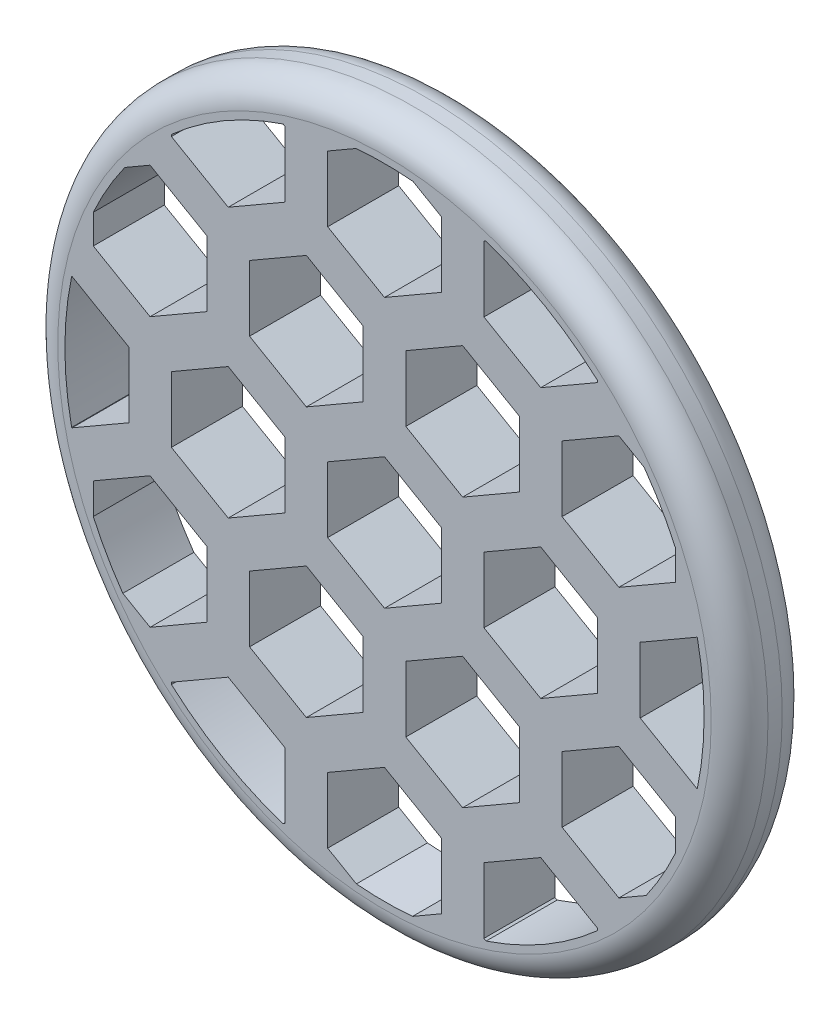
from build123d import *

# Parameters (mm, degrees)
SKETCH1_R           = 25
BOSS_EXTRUDE3_DEPTH = 5
FILLET3_R           = 2


with BuildPart() as part:
    # Sketch1 → Boss-Extrude3 (new body)
    with BuildSketch(Plane.XY):
        Circle(SKETCH1_R)
        with BuildLine():
            Line((-16.5, -14.028532992), (-18.42121658, -12.919318082))
            ThreePointArc((-18.42121658, -12.919318082), (-19.545793828, -11.145041212), (-20.5, -9.273618495))
            Line((-20.5, -9.273618495), (-20.5, -7.100329762))
            Line((-20.5, -7.100329762), (-16.5, -4.790928685))
            Line((-16.5, -4.790928685), (-12.5, -7.100329762))
            Line((-12.5, -7.100329762), (-12.5, -11.719131915))
            Line((-12.5, -11.719131915), (-16.5, -14.028532992))
        make_face(mode=Mode.SUBTRACT)
        with BuildLine():
            Line((-15, -16.770509831), (-15, -16.626609203))
            Line((-15, -16.626609203), (-11, -14.317208127))
            Line((-11, -14.317208127), (-7, -16.626609203))
            Line((-7, -16.626609203), (-7, -21.245411357))
            Line((-7, -21.245411357), (-7.1518668, -21.333091695))
            ThreePointArc((-7.1518668, -21.333091695), (-11.308429997, -19.451720001), (-15, -16.770509831))
        make_face(mode=Mode.SUBTRACT)
        with BuildLine():
            Line((-22, -4.618802154), (-22.023687548, -4.605126141))
            ThreePointArc((-22.023687548, -4.605126141), (-22.5, 0), (-22.023687548, 4.605126141))
            Line((-22.023687548, 4.605126141), (-22, 4.618802154))
            Line((-22, 4.618802154), (-18, 2.309401077))
            Line((-18, 2.309401077), (-18, -2.309401077))
            Line((-18, -2.309401077), (-22, -4.618802154))
        make_face(mode=Mode.SUBTRACT)
        Polygon((-1.5, -11.719131915), (-5.5, -14.028532992), (-9.5, -11.719131915), (-9.5, -7.100329762), (-5.5, -4.790928685), (-1.5, -7.100329762), align=None, mode=Mode.SUBTRACT)
        Polygon((-7, -2.309401077), (-11, -4.618802154), (-15, -2.309401077), (-15, 2.309401077), (-11, 4.618802154), (-7, 2.309401077), align=None, mode=Mode.SUBTRACT)
        with BuildLine():
            Line((4, -21.245411357), (1.977849369, -22.412900568))
            ThreePointArc((1.977849369, -22.412900568), (0, -22.5), (-1.977849369, -22.412900568))
            Line((-1.977849369, -22.412900568), (-4, -21.245411357))
            Line((-4, -21.245411357), (-4, -16.626609203))
            Line((-4, -16.626609203), (0, -14.317208127))
            Line((0, -14.317208127), (4, -16.626609203))
            Line((4, -16.626609203), (4, -21.245411357))
        make_face(mode=Mode.SUBTRACT)
        with BuildLine():
            Line((7.1518668, -21.333091695), (7, -21.245411357))
            Line((7, -21.245411357), (7, -16.626609203))
            Line((7, -16.626609203), (11, -14.317208127))
            Line((11, -14.317208127), (15, -16.626609203))
            Line((15, -16.626609203), (15, -16.770509831))
            ThreePointArc((15, -16.770509831), (11.308429997, -19.451720001), (7.1518668, -21.333091695))
        make_face(mode=Mode.SUBTRACT)
        Polygon((9.5, -11.719131915), (5.5, -14.028532992), (1.5, -11.719131915), (1.5, -7.100329762), (5.5, -4.790928685), (9.5, -7.100329762), align=None, mode=Mode.SUBTRACT)
        with BuildLine():
            Line((20.5, -7.100329762), (20.5, -9.273618496))
            ThreePointArc((20.5, -9.273618496), (19.545793828, -11.145041212), (18.42121658, -12.919318082))
            Line((18.42121658, -12.919318082), (16.5, -14.028532992))
            Line((16.5, -14.028532992), (12.5, -11.719131915))
            Line((12.5, -11.719131915), (12.5, -7.100329762))
            Line((12.5, -7.100329762), (16.5, -4.790928685))
            Line((16.5, -4.790928685), (20.5, -7.100329762))
        make_face(mode=Mode.SUBTRACT)
        with BuildLine():
            Line((-20.5, 7.216878365), (-20.5, 9.273618495))
            ThreePointArc((-20.5, 9.273618495), (-19.485571585, 11.25), (-18.281189202, 13.11671153))
            Line((-18.281189202, 13.11671153), (-16.5, 14.145081595))
            Line((-16.5, 14.145081595), (-12.5, 11.835680518))
            Line((-12.5, 11.835680518), (-12.5, 7.216878365))
            Line((-12.5, 7.216878365), (-16.5, 4.907477288))
            Line((-16.5, 4.907477288), (-20.5, 7.216878365))
        make_face(mode=Mode.SUBTRACT)
        Polygon((4, -2.309401077), (0, -4.618802154), (-4, -2.309401077), (-4, 2.309401077), (0, 4.618802154), (4, 2.309401077), align=None, mode=Mode.SUBTRACT)
        Polygon((-1.5, 7.216878365), (-5.5, 4.907477288), (-9.5, 7.216878365), (-9.5, 11.835680518), (-5.5, 14.145081595), (-1.5, 11.835680518), align=None, mode=Mode.SUBTRACT)
        with BuildLine():
            ThreePointArc((-15, 16.770509831), (-11.301438227, 19.455783048), (-7.136530526, 21.338227013))
            Line((-7.136530526, 21.338227013), (-7, 21.259401077))
            Line((-7, 21.259401077), (-7, 16.640598923))
            Line((-7, 16.640598923), (-11, 14.331197846))
            Line((-11, 14.331197846), (-15, 16.640598923))
            Line((-15, 16.640598923), (-15, 16.770509831))
        make_face(mode=Mode.SUBTRACT)
        with BuildLine():
            Line((-4, 21.259401077), (-2.006489815, 22.410354719))
            ThreePointArc((-2.006489815, 22.410354719), (0, 22.5), (2.006489815, 22.410354719))
            Line((2.006489815, 22.410354719), (4, 21.259401077))
            Line((4, 21.259401077), (4, 16.640598923))
            Line((4, 16.640598923), (0, 14.331197846))
            Line((0, 14.331197846), (-4, 16.640598923))
            Line((-4, 16.640598923), (-4, 21.259401077))
        make_face(mode=Mode.SUBTRACT)
        Polygon((15, -2.309401077), (11, -4.618802154), (7, -2.309401077), (7, 2.309401077), (11, 4.618802154), (15, 2.309401077), align=None, mode=Mode.SUBTRACT)
        Polygon((9.5, 7.216878365), (5.5, 4.907477288), (1.5, 7.216878365), (1.5, 11.835680518), (5.5, 14.145081595), (9.5, 11.835680518), align=None, mode=Mode.SUBTRACT)
        with BuildLine():
            Line((22.023687548, -4.605126141), (22, -4.618802154))
            Line((22, -4.618802154), (18, -2.309401077))
            Line((18, -2.309401077), (18, 2.309401077))
            Line((18, 2.309401077), (22, 4.618802154))
            Line((22, 4.618802154), (22.023687548, 4.605126141))
            ThreePointArc((22.023687548, 4.605126141), (22.5, 0), (22.023687548, -4.605126141))
        make_face(mode=Mode.SUBTRACT)
        with BuildLine():
            Line((20.5, 7.216878365), (16.5, 4.907477288))
            Line((16.5, 4.907477288), (12.5, 7.216878365))
            Line((12.5, 7.216878365), (12.5, 11.835680518))
            Line((12.5, 11.835680518), (16.5, 14.145081595))
            Line((16.5, 14.145081595), (18.281189202, 13.11671153))
            ThreePointArc((18.281189202, 13.11671153), (19.485571585, 11.25), (20.5, 9.273618496))
            Line((20.5, 9.273618496), (20.5, 7.216878365))
        make_face(mode=Mode.SUBTRACT)
        with BuildLine():
            ThreePointArc((7.136530526, 21.338227013), (11.301438227, 19.455783048), (15, 16.770509831))
            Line((15, 16.770509831), (15, 16.640598923))
            Line((15, 16.640598923), (11, 14.331197846))
            Line((11, 14.331197846), (7, 16.640598923))
            Line((7, 16.640598923), (7, 21.259401077))
            Line((7, 21.259401077), (7.136530526, 21.338227013))
        make_face(mode=Mode.SUBTRACT)
    extrude(amount=BOSS_EXTRUDE3_DEPTH)

    # Fillet3
    fillet3_edges = [part.edges().sort_by_distance(p)[0] for p in [
        (-25, 0, 0),
        (-25, 0, 5),
    ]]
    fillet(fillet3_edges, radius=FILLET3_R)


solid = part.part
